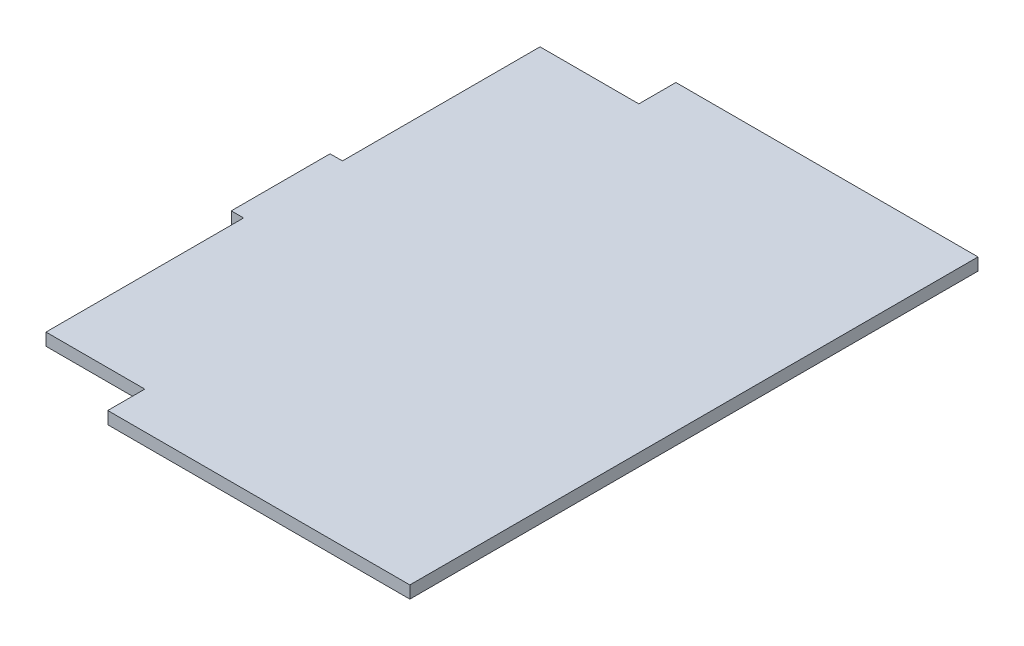
from build123d import *

# Parameters (mm, degrees)
BOSS_EXTRUDE1_DEPTH = 3.175
SKETCH2_W           = 29.21
SKETCH2_H           = 146.05
CUT_EXTRUDE1_DEPTH  = 101.731234192


with BuildPart() as part:
    # Sketch1 → Boss-Extrude1 (new body)
    with BuildSketch(Plane(origin=(0, 0, 0), x_dir=(1, 0, 0), z_dir=(0, 1, 0))):
        Polygon((-40.736256602, -73.025), (59.786256602, -73.025), (59.786256602, -63.5), (66.136256602, -63.5), (66.136256602, 63.5), (59.786256602, 63.5), (59.786256602, 73.025), (-40.736256602, 73.025), (-40.736256602, 63.5), (-66.136256602, 63.5), (-66.136256602, 12.7), (-69.311256602, 12.7), (-69.311256602, -12.7), (-66.136256602, -12.7), (-66.136256602, -63.5), (-40.736256602, -63.5), align=None)
    extrude(amount=BOSS_EXTRUDE1_DEPTH)

    # Sketch2 → Cut-Extrude1 (cut, through all)
    with BuildSketch(Plane.XZ):
        with Locations((51.531256602, 0)):
            Rectangle(SKETCH2_W, SKETCH2_H)
    extrude(amount=-CUT_EXTRUDE1_DEPTH, mode=Mode.SUBTRACT)


solid = part.part
